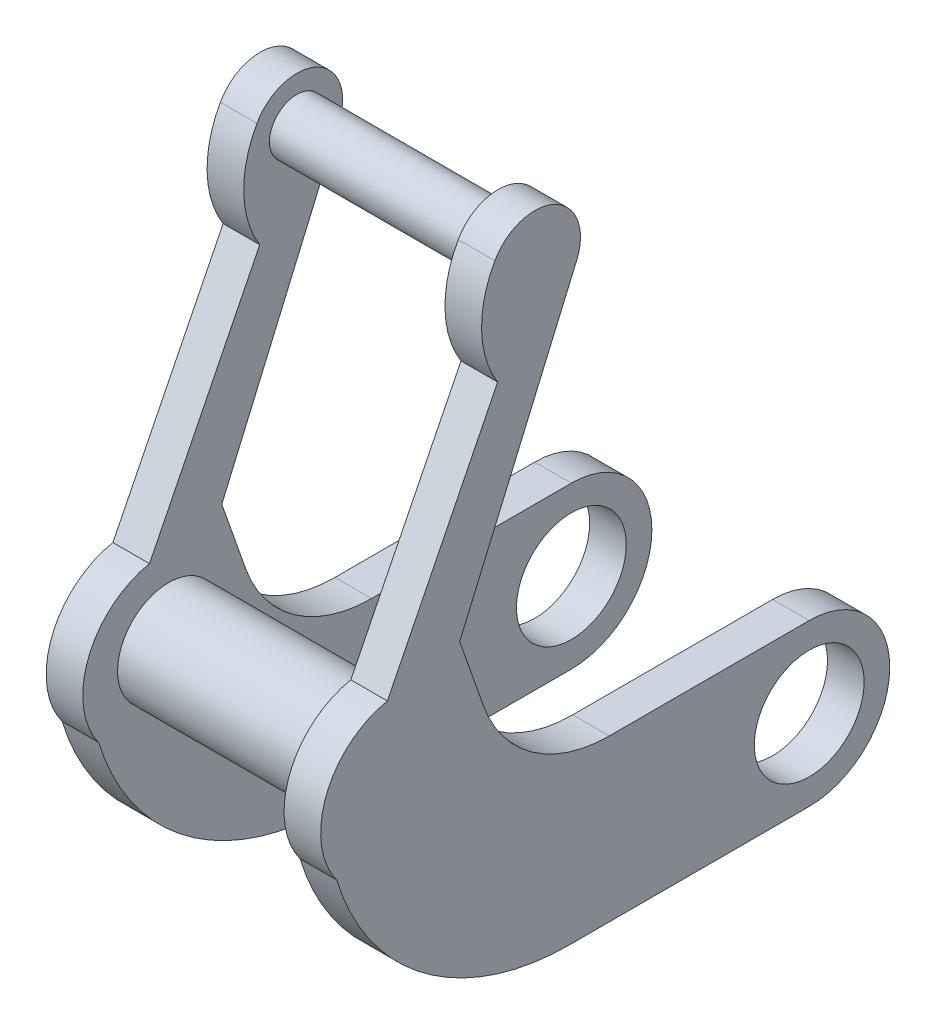
from build123d import *

# Parameters (mm, degrees)
SKETCH1_R           = 30
BOSS_EXTRUDE1_DEPTH = 20
SKETCH2_R           = 15
BOSS_EXTRUDE2_DEPTH = 55
SKETCH3_R           = 28
BOSS_EXTRUDE3_DEPTH = 55


with BuildPart() as part:
    # Sketch1 → Boss-Extrude1 (new body)
    with BuildSketch(Plane(origin=(0, 0, 0), x_dir=(0, 0, -1), z_dir=(1, 0, 0))):
        with BuildLine():
            Line((0, -44), (-131, -44))
            ThreePointArc((-131, -44), (-210.210724185, -17.839417698), (-258.260566126, 50.350959788))
            ThreePointArc((-258.260566126, 50.350959788), (-263.903546034, 93.404049189), (-230.531495232, 121.183861184))
            Line((-230.531495232, 121.183861184), (-170.294790462, 242))
            ThreePointArc((-170.294790462, 242), (-179.048984689, 270.890098256), (-171.821418425, 300.199413834))
            ThreePointArc((-171.821418425, 300.199413834), (-138.941281444, 310.421078117), (-127.038840466, 278.111362436))
            Line((-127.038840466, 278.111362436), (-191.024673217, 129.537921032))
            Line((-191.024673217, 129.537921032), (-178.070389074, 92.752237372))
            ThreePointArc((-178.070389074, 92.752237372), (-151.398741624, 57.421955924), (-109.215135044, 44))
            Line((-109.215135044, 44), (0, 44))
            ThreePointArc((0, 44), (44, 0), (0, -44))
        make_face()
        Circle(SKETCH1_R, mode=Mode.SUBTRACT)
    extrude(amount=BOSS_EXTRUDE1_DEPTH)


with BuildPart() as body_2:
    # Mirror2: mirrored copy
    add(part.part.mirror(Plane(origin=(-55, 0, 0), x_dir=(0, 0, 1), z_dir=(1, 0, 0))))


with BuildPart() as part_1:
    add(part.part)

    add(body_2.part)  # Boss-Extrude2 merges body 2
    # Sketch2 → Boss-Extrude2 (add, symmetric)
    with BuildSketch(Plane(origin=(-55, 0, 0), x_dir=(0, 0, -1), z_dir=(1, 0, 0))):
        with Locations(Location((-150, 288, 0), (0, 0, 180))):
            Circle(SKETCH2_R)
    extrude(amount=BOSS_EXTRUDE2_DEPTH, both=True)

    # Sketch3 → Boss-Extrude3 (add, symmetric)
    with BuildSketch(Plane(origin=(-55, 0, 0), x_dir=(0, 0, -1), z_dir=(1, 0, 0))):
        with Locations(Location((-220, 79, 0), (0, 0, 180))):
            Circle(SKETCH3_R)
    extrude(amount=BOSS_EXTRUDE3_DEPTH, both=True)


solid = part_1.part
